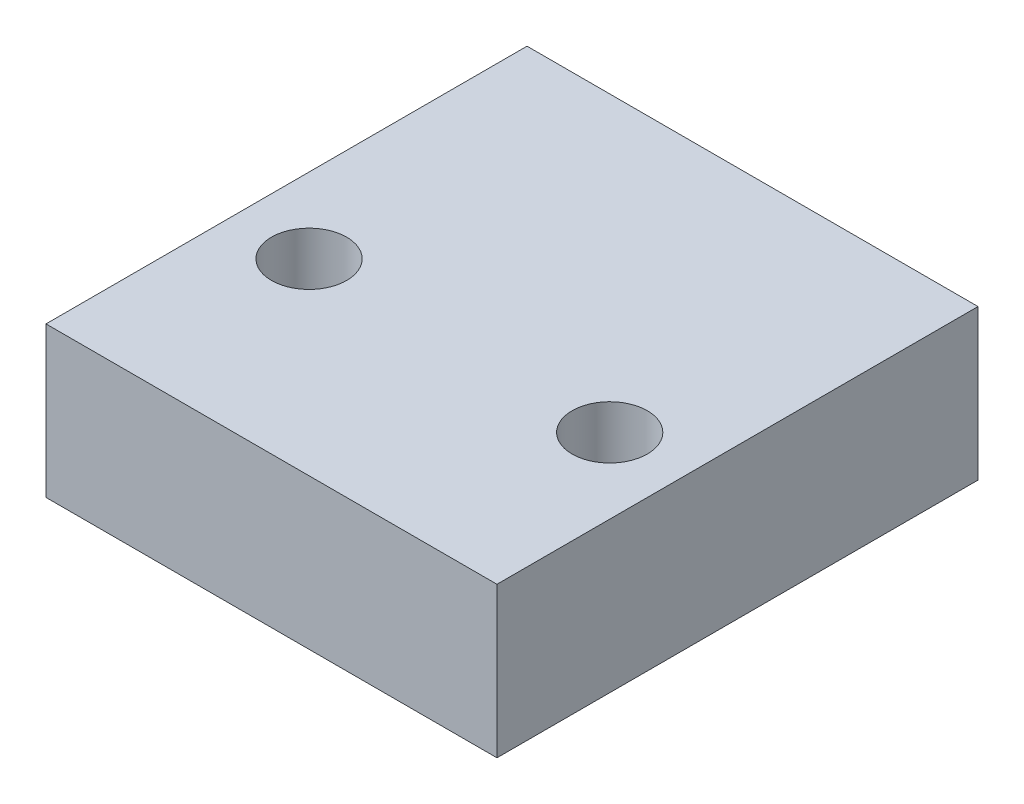
from build123d import *

# Parameters (mm, degrees)
SKETCH1_W           = 30
SKETCH1_H           = 22
SKETCH1_H_2         = 32
SKETCH1_R           = 2.5
BOSS_EXTRUDE1_DEPTH = 10


with BuildPart() as part:
    # Sketch1 → Boss-Extrude1 (new body)
    # profile 1 of 2: a face of its own
    with BuildSketch(Plane(origin=(0, 0, 0), x_dir=(1, 0, 0), z_dir=(0, 1, 0))):
        with Locations((0, 3.5)):
            Rectangle(SKETCH1_W, SKETCH1_H)
        with BuildLine():
            ThreePointArc((-7.5, -2.5), (-10, -5), (-12.5, -2.5))
            Line((-12.5, -2.5), (-12.5, 0))
            Line((-12.5, 0), (-12.5, 2.5))
            ThreePointArc((-12.5, 2.5), (-10, 5), (-7.5, 2.5))
            Line((-7.5, 2.5), (-7.5, 0))
            Line((-7.5, 0), (-7.5, -2.5))
        make_face(mode=Mode.SUBTRACT)
        with BuildLine():
            ThreePointArc((12.5, -2.5), (10, -5), (7.5, -2.5))
            Line((7.5, -2.5), (7.5, 0))
            Line((7.5, 0), (7.5, 2.5))
            ThreePointArc((7.5, 2.5), (10, 5), (12.5, 2.5))
            Line((12.5, 2.5), (12.5, 0))
            Line((12.5, 0), (12.5, -2.5))
        make_face(mode=Mode.SUBTRACT)
    # profile 2 of 2: a face of its own
    with BuildSketch(Plane(origin=(0, 0, 0), x_dir=(1, 0, 0), z_dir=(0, 1, 0))):
        with Locations((0, 3.5)):
            Rectangle(SKETCH1_W, SKETCH1_H_2)
        with Locations(Location((10, 0, 0), (0, 0, 270))):
            Circle(SKETCH1_R, mode=Mode.SUBTRACT)
        with Locations(Location((-10, 0, 0), (0, 0, 270))):
            Circle(SKETCH1_R, mode=Mode.SUBTRACT)
    extrude(amount=BOSS_EXTRUDE1_DEPTH)


solid = part.part
